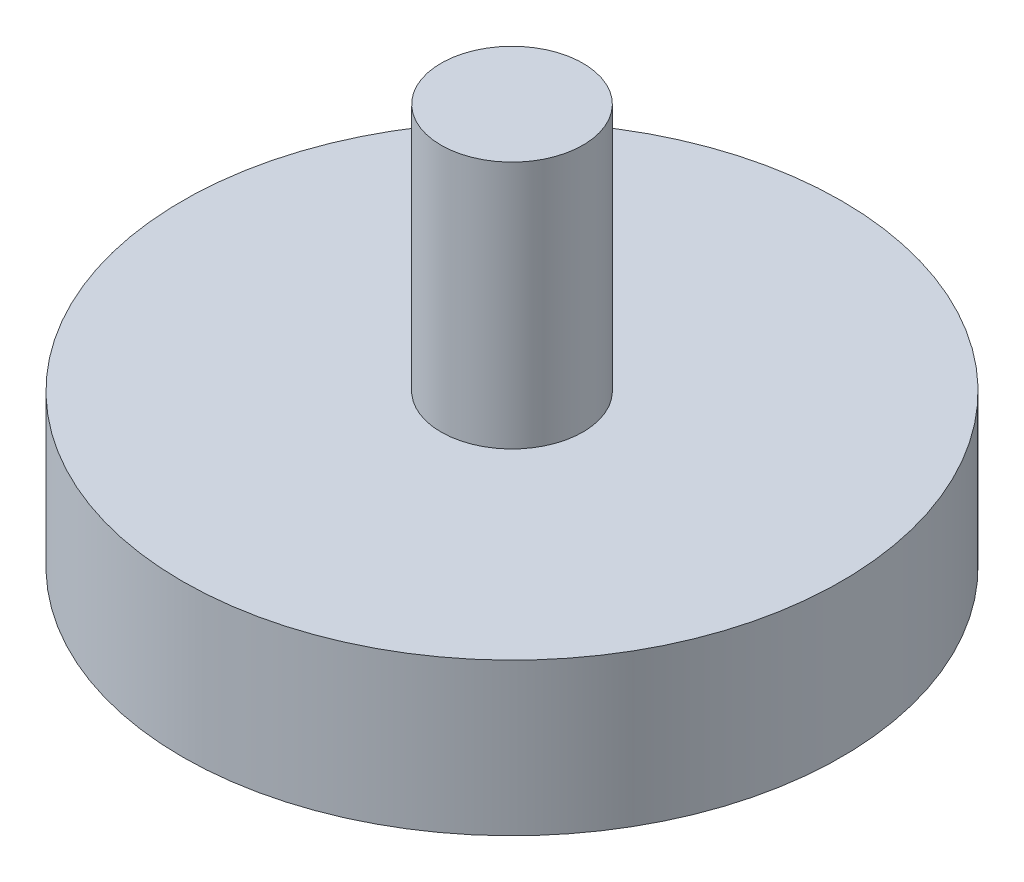
from build123d import *

# Parameters (mm, degrees)
SKETCH1_R           = 3.556
BOSS_EXTRUDE1_DEPTH = 12.446
SKETCH1_3_R         = 16.51
BOSS_EXTRUDE2_DEPTH = 7.62


with BuildPart() as part:
    # Sketch1 → Boss-Extrude1 (new body)
    with BuildSketch(Plane(origin=(0, 0, 0), x_dir=(1, 0, 0), z_dir=(0, 1, 0))):
        Circle(SKETCH1_R)
    extrude(amount=BOSS_EXTRUDE1_DEPTH)


with BuildPart() as body_2:
    # Sketch1<3> → Boss-Extrude2 (new body)
    with BuildSketch(Plane(origin=(0, 0, 0), x_dir=(1, 0, 0), z_dir=(0, 1, 0))):
        Circle(SKETCH1_3_R)
    extrude(amount=-BOSS_EXTRUDE2_DEPTH)


solid = Compound([part.part, body_2.part])
